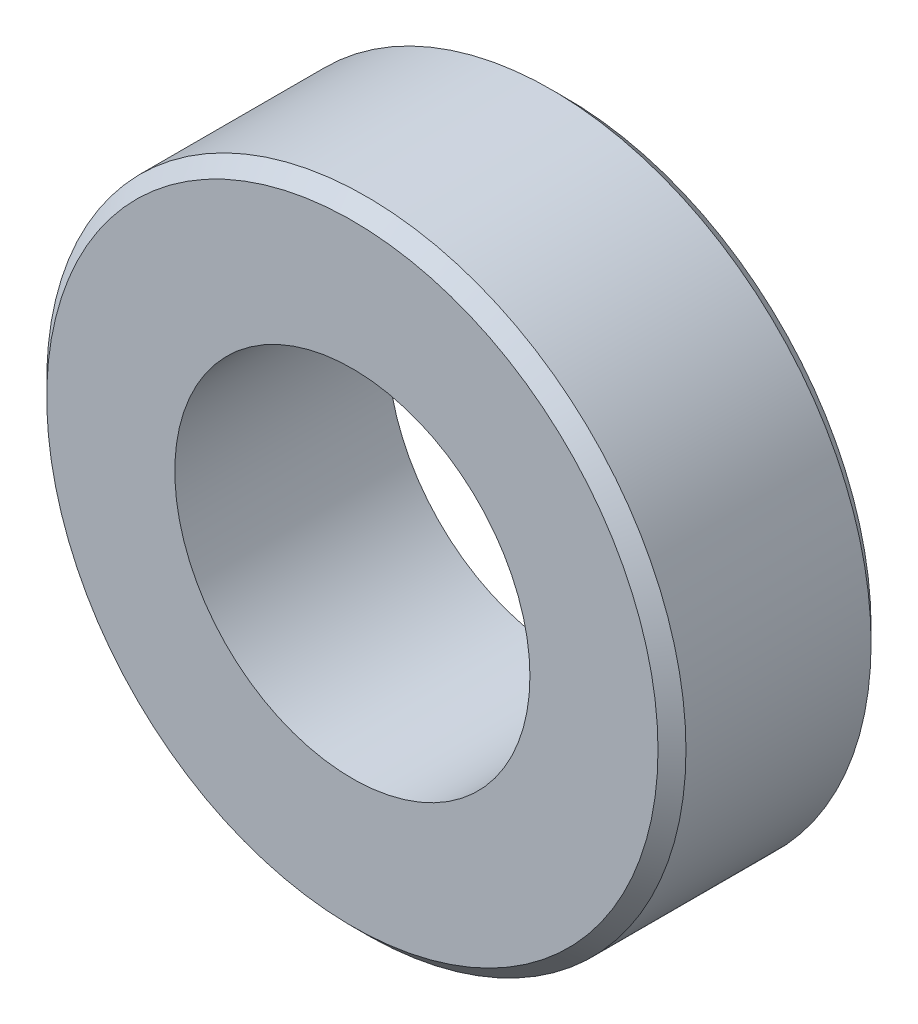
from build123d import *

# Parameters (mm, degrees)
SKETCH1_R           = 11.43
SKETCH1_R_2         = 6.35
BOSS_EXTRUDE1_DEPTH = 3.81
CHAMFER1_SIZE       = 0.5


with BuildPart() as part:
    # Sketch1 → Boss-Extrude1 (new, symmetric)
    with BuildSketch(Plane.XY):
        Circle(SKETCH1_R)
        Circle(SKETCH1_R_2, mode=Mode.SUBTRACT)
    extrude(amount=BOSS_EXTRUDE1_DEPTH, both=True)

    # Chamfer1
    chamfer1_edges = [part.edges().sort_by_distance(p)[0] for p in [
        (-11.43, 0, -3.81),
        (-11.43, 0, 3.81),
    ]]
    chamfer(chamfer1_edges, length=CHAMFER1_SIZE)


solid = part.part
